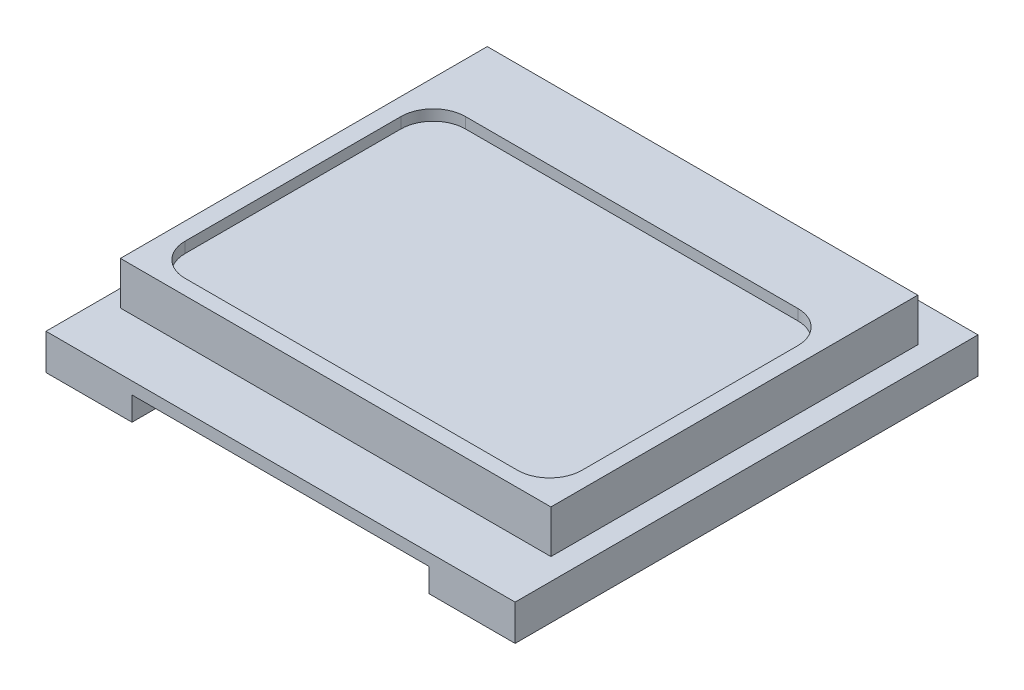
from build123d import *

# Parameters (mm, degrees)
SKETCH1_W           = 43.63
SKETCH1_H           = 43.05
BOSS_EXTRUDE1_DEPTH = 1.13
SKETCH2_W           = 40.04
SKETCH2_H           = 34.12
BOSS_EXTRUDE2_DEPTH = 4
SKETCH4_W           = 36.91
SKETCH4_H           = 26.07
CUT_EXTRUDE1_DEPTH  = 1
FILLET1_R           = 3
SKETCH5_W           = 21
SKETCH5_H           = 9
BOSS_EXTRUDE3_DEPTH = 10
SKETCH6_W           = 8
SKETCH6_H           = 43.05
BOSS_EXTRUDE4_DEPTH = 2.2


with BuildPart() as part:
    # Sketch1 → Boss-Extrude1 (new body)
    with BuildSketch(Plane(origin=(0, 0, 0), x_dir=(1, 0, 0), z_dir=(0, 1, 0))):
        Rectangle(SKETCH1_W, SKETCH1_H)
    extrude(amount=BOSS_EXTRUDE1_DEPTH)

    # Sketch2 → Boss-Extrude2 (add)
    with BuildSketch(Plane(origin=(0, 1.13, 0), x_dir=(1, 0, 0), z_dir=(0, 1, 0))):
        with Locations((-0.205, 0.865)):
            Rectangle(SKETCH2_W, SKETCH2_H)
    extrude(amount=BOSS_EXTRUDE2_DEPTH)

    # Sketch4 → Cut-Extrude1 (cut)
    with BuildSketch(Plane(origin=(0, 5.13, 0), x_dir=(1, 0, 0), z_dir=(0, 1, 0))):
        with Locations((-0.15, -1.76)):
            Rectangle(SKETCH4_W, SKETCH4_H)
    extrude(amount=-CUT_EXTRUDE1_DEPTH, mode=Mode.SUBTRACT)

    # Fillet1
    fillet1_edges = [part.edges().sort_by_distance(p)[0] for p in [
        (-18.605, 4.63, 14.795),
        (-18.605, 4.63, -11.275),
        (18.305, 4.63, -11.275),
        (18.305, 4.63, 14.795),
    ]]
    fillet(fillet1_edges, radius=FILLET1_R)

    # Sketch5 → Boss-Extrude3 (add)
    with BuildSketch(Plane.XZ):
        with Locations((0, -17.025)):
            Rectangle(SKETCH5_W, SKETCH5_H)
    extrude(amount=BOSS_EXTRUDE3_DEPTH)

    # Sketch6 → Boss-Extrude4 (add)
    with BuildSketch(Plane.XZ):
        with Locations((17.815, 0)):
            Rectangle(SKETCH6_W, SKETCH6_H)
        with Locations((-17.815, 0)):
            Rectangle(SKETCH6_W, SKETCH6_H)
    extrude(amount=BOSS_EXTRUDE4_DEPTH)


solid = part.part
